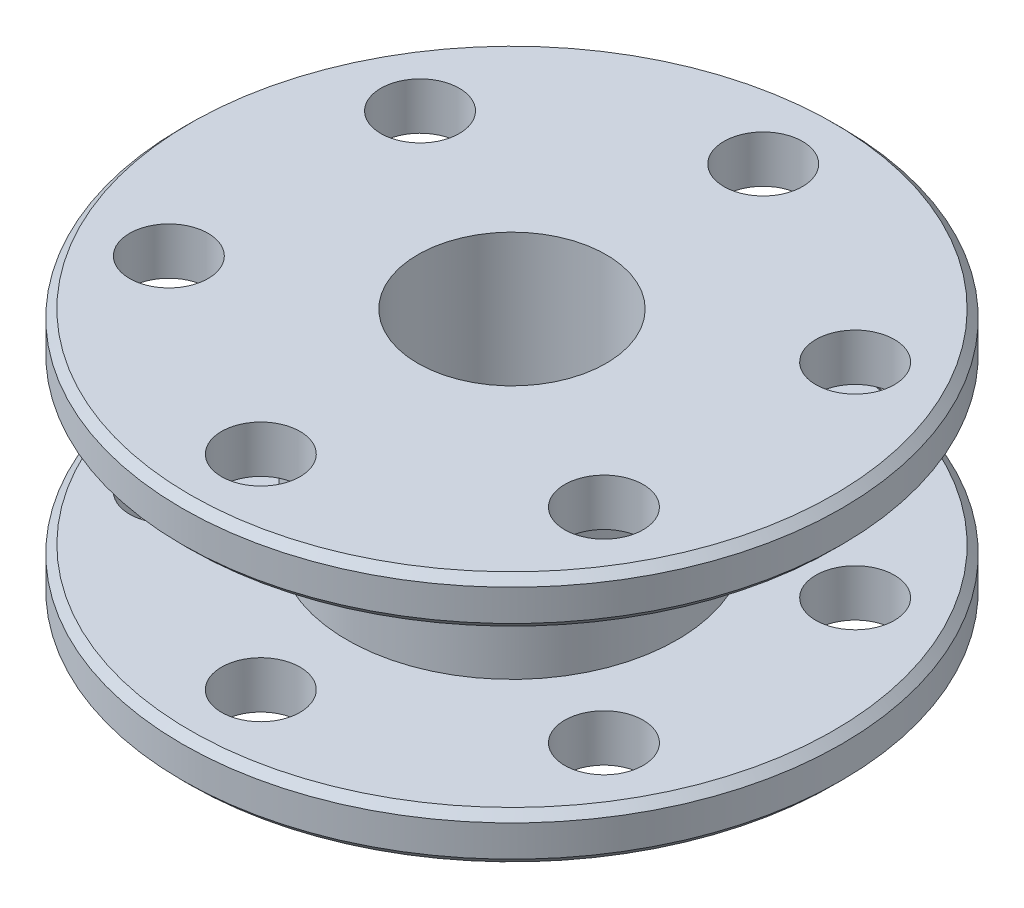
from build123d import *

# Parameters (mm, degrees)
SKETCH1_R           = 21
SKETCH1_R_2         = 6
SKETCH1_R_3         = 2.5
BOSS_EXTRUDE1_DEPTH = 16
SKETCH2_W           = 19.556392274
SKETCH2_H           = 10
CHAMFER1_SIZE       = 0.5
CHAMFER2_SIZE       = 0.5


with BuildPart() as part:
    # Sketch1 → Boss-Extrude1 (new body)
    with BuildSketch(Plane(origin=(0, 0, 0), x_dir=(1, 0, 0), z_dir=(0, 1, 0))):
        with Locations(Location((0, 0, 0), (0, 0, 270))):
            Circle(SKETCH1_R)
        with Locations(Location((0, 0, 0), (0, 0, 270))):
            Circle(SKETCH1_R_2, mode=Mode.SUBTRACT)
        with Locations(Location((0, 16, 0), (0, 0, 270))):
            Circle(SKETCH1_R_3, mode=Mode.SUBTRACT)
        with Locations(Location((13.856406461, 8, 0), (0, 0, 270))):
            Circle(SKETCH1_R_3, mode=Mode.SUBTRACT)
        with Locations(Location((13.856406461, -8, 0), (0, 0, 270))):
            Circle(SKETCH1_R_3, mode=Mode.SUBTRACT)
        with Locations(Location((0, -16, 0), (0, 0, 270))):
            Circle(SKETCH1_R_3, mode=Mode.SUBTRACT)
        with Locations(Location((-13.856406461, -8, 0), (0, 0, 270))):
            Circle(SKETCH1_R_3, mode=Mode.SUBTRACT)
        with Locations(Location((-13.856406461, 8, 0), (0, 0, 270))):
            Circle(SKETCH1_R_3, mode=Mode.SUBTRACT)
    extrude(amount=BOSS_EXTRUDE1_DEPTH)

    # Sketch2 → Cut-Revolve1 (revolve, cut)
    with BuildSketch(Plane(origin=(0, 0, 0), x_dir=(0, 0, -1), z_dir=(1, 0, 0))):
        with Locations((20.288576043, 8)):
            Rectangle(SKETCH2_W, SKETCH2_H)
    revolve(axis=Axis((0, 0, 0), (0, 1, 0)), mode=Mode.SUBTRACT)

    # Chamfer1
    chamfer1_edges = [part.edges().sort_by_distance(p)[0] for p in [
        (0, 3, -21),
        (0, 13, -21),
    ]]
    chamfer(chamfer1_edges, length=CHAMFER1_SIZE)

    # Chamfer2
    chamfer2_edges = [part.edges().sort_by_distance(p)[0] for p in [
        (0, 0, -21),
        (0, 16, -21),
    ]]
    chamfer(chamfer2_edges, length=CHAMFER2_SIZE)


solid = part.part
